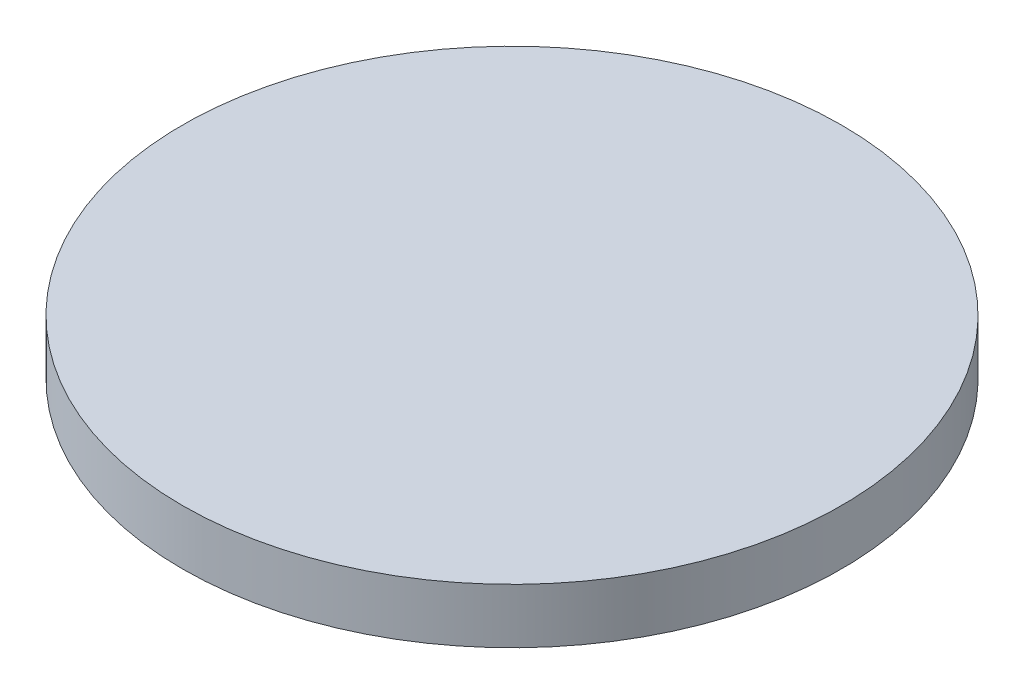
from build123d import *

# Parameters (mm, degrees)
SKETCH1_R           = 30
BOSS_EXTRUDE1_DEPTH = 5
CUT_EXTRUDE1_DEPTH  = 2.5


with BuildPart() as part:
    # Sketch1 → Boss-Extrude1 (new body)
    with BuildSketch(Plane(origin=(0, 0, 0), x_dir=(1, 0, 0), z_dir=(0, 1, 0))):
        with Locations(Location((0, 0, 0), (0, 0, 270))):
            Circle(SKETCH1_R)
    extrude(amount=BOSS_EXTRUDE1_DEPTH)

    # Sketch2 → Cut-Extrude1 (cut)
    with BuildSketch(Plane.XZ):
        with BuildLine():
            Line((-3.040359584, -5.288309144), (3.065215801, -16.909184089))
            ThreePointArc((3.065215801, -16.909184089), (6.199058144, -18.03286479), (7.979586598, -15.219798034))
            Line((7.979586598, -15.219798034), (5.649329711, -2.301102739))
            ThreePointArc((5.649329711, -2.301102739), (5.7686626, 1.983061221), (3.040359584, 5.288309144))
            Line((3.040359584, 5.288309144), (-3.065215801, 16.909184089))
            ThreePointArc((-3.065215801, 16.909184089), (-6.199058144, 18.03286479), (-7.979586598, 15.219798034))
            Line((-7.979586598, 15.219798034), (-5.649329711, 2.301102739))
            ThreePointArc((-5.649329711, 2.301102739), (-5.7686626, -1.983061221), (-3.040359584, -5.288309144))
        make_face()
    extrude(amount=-CUT_EXTRUDE1_DEPTH, mode=Mode.SUBTRACT)


solid = part.part
